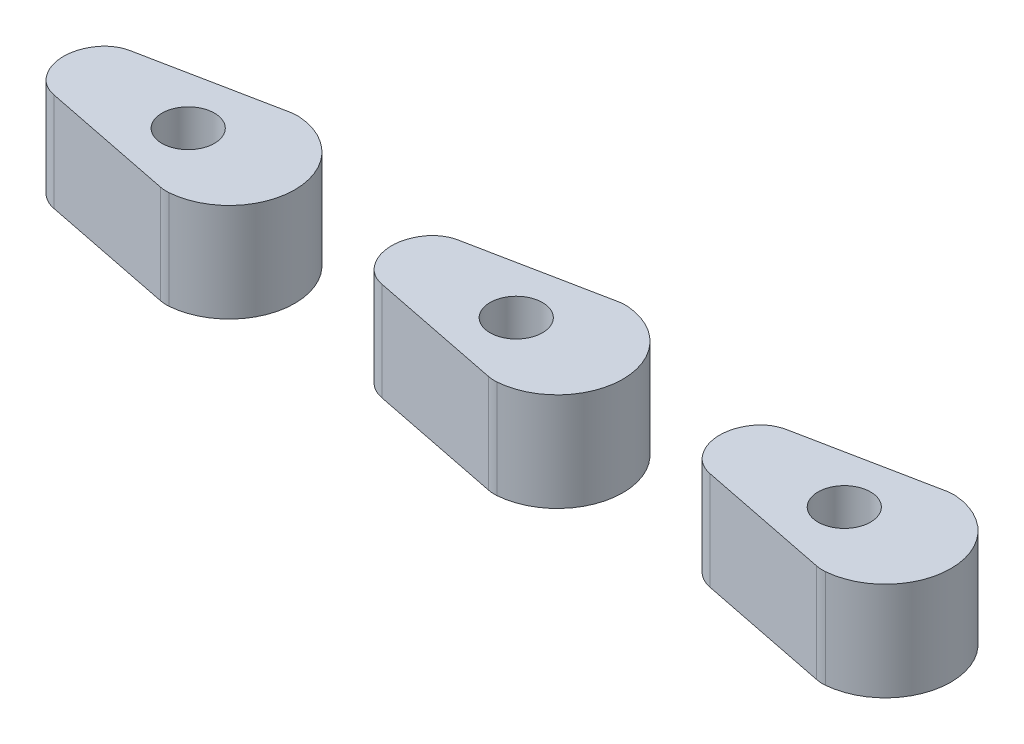
from build123d import *

# Parameters (mm, degrees)
SKETCH1_R           = 0.8
BOSS_EXTRUDE1_DEPTH = 3
LPATTERN1_COUNT     = 3
LPATTERN1_PITCH     = 10


with BuildPart() as part:
    # Sketch1 → Boss-Extrude1 (new body)
    with BuildSketch(Plane(origin=(0, 0, 0), x_dir=(1, 0, 0), z_dir=(0, 1, 0))):
        with BuildLine():
            ThreePointArc((0.164100898, -1.993256355), (2, -1e-09), (0.1641009, 1.993256355))
            ThreePointArc((0.1641009, 1.993256355), (0.024548565, 1.994973575), (-0.113883759, 1.977245221))
            Line((-0.113883759, 1.977245221), (-4.183235691, 1.164159973))
            ThreePointArc((-4.183235691, 1.164159973), (-4.514100231, 1.033532975), (-4.77830642, 0.795352694))
            ThreePointArc((-4.77830642, 0.795352694), (-4.980202899, 0.420239012), (-5.05, 0))
            ThreePointArc((-5.05, 0), (-4.980202899, -0.420239012), (-4.77830642, -0.795352694))
            ThreePointArc((-4.77830642, -0.795352694), (-4.514100231, -1.033532975), (-4.183235691, -1.164159973))
            Line((-4.183235691, -1.164159973), (-0.11388376, -1.977245221))
            ThreePointArc((-0.11388376, -1.977245221), (0.024548564, -1.994973575), (0.164100898, -1.993256355))
        make_face()
        with Locations(Location((-1.25, 0, 0), (0, 0, 270))):
            Circle(SKETCH1_R, mode=Mode.SUBTRACT)
    extrude(amount=BOSS_EXTRUDE1_DEPTH)


with BuildPart() as lpattern1_1:
    # LPattern1: pattern copy
    add(part.part.moved(Location(Vector(-1, 0, 0) * (1 * LPATTERN1_PITCH))))


with BuildPart() as lpattern1_2:
    # LPattern1: pattern copy
    add(part.part.moved(Location(Vector(-1, 0, 0) * (2 * LPATTERN1_PITCH))))


solid = Compound([part.part, lpattern1_1.part, lpattern1_2.part])
